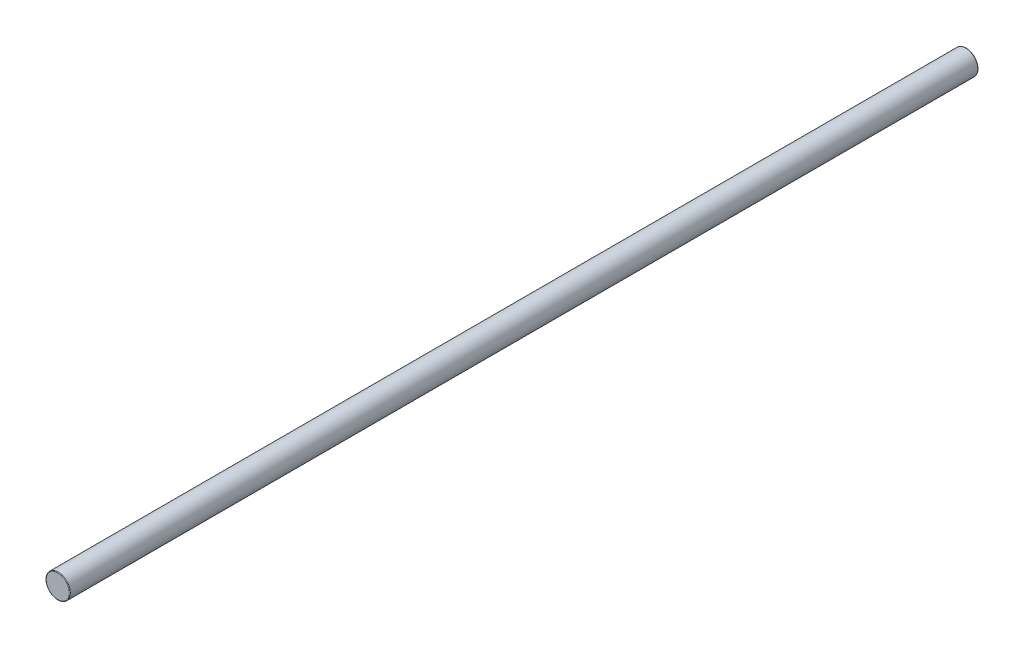
from build123d import *

# Parameters (mm, degrees)
SKETCH1_R           = 4
BOSS_EXTRUDE1_DEPTH = 300
FILLET1_R           = 0.2


with BuildPart() as part:
    # Sketch1 → Boss-Extrude1 (new body)
    with BuildSketch(Plane.XY):
        Circle(SKETCH1_R)
    extrude(amount=-BOSS_EXTRUDE1_DEPTH)

    # Fillet1
    fillet1_edges = [part.edges().sort_by_distance(p)[0] for p in [
        (-4, 0, -300),
        (-4, 0, 0),
    ]]
    fillet(fillet1_edges, radius=FILLET1_R)


solid = part.part
